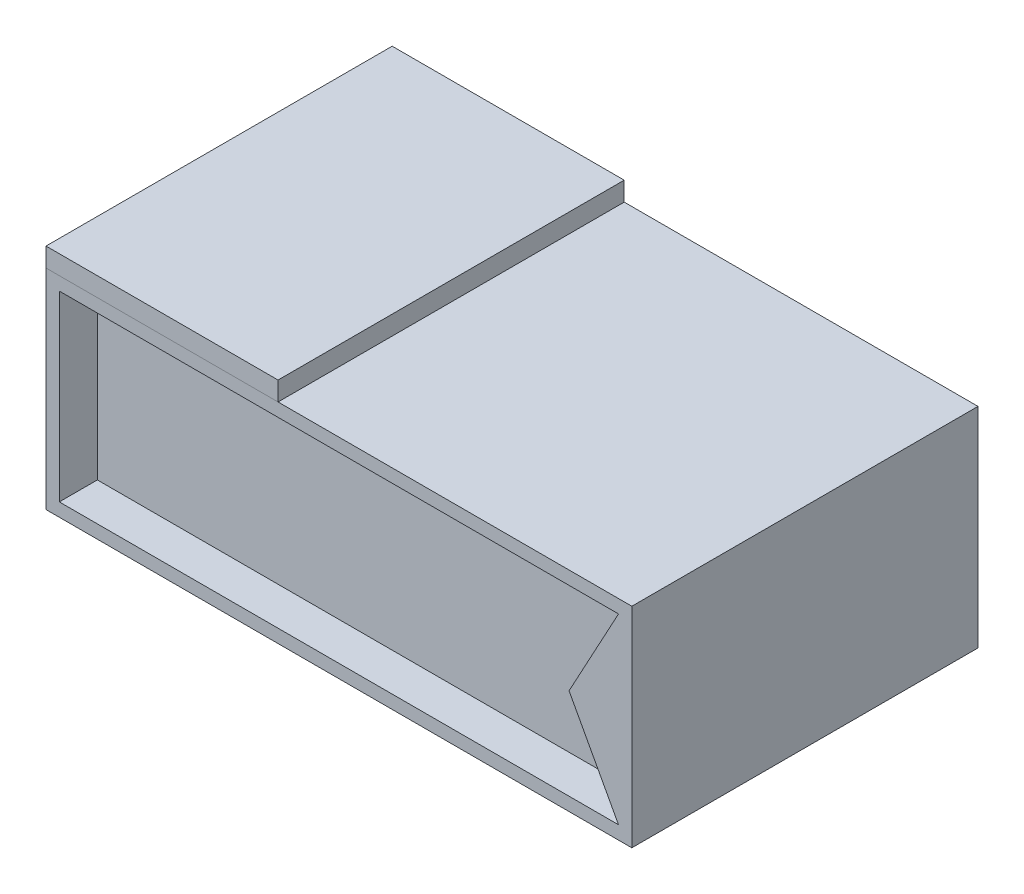
from build123d import *

# Parameters (mm, degrees)
ESQUISSE1_W             = 91
ESQUISSE1_H             = 55
BOSS_EXTRU_1_DEPTH      = 77
ESQUISSE3_W             = 61
ESQUISSE3_H             = 91
BOSS_EXTRU_2_DEPTH      = 5
ENL_V_MAT_EXTRU_1_DEPTH = 10


with BuildPart() as part:
    # Esquisse1 → Boss.-Extru.1 (new, symmetric)
    with BuildSketch(Plane(origin=(0, 0, 0), x_dir=(0, 0, -1), z_dir=(1, 0, 0))):
        Rectangle(ESQUISSE1_W, ESQUISSE1_H)
    extrude(amount=BOSS_EXTRU_1_DEPTH, both=True)

    # Esquisse4 → Enlèv. mat.-Extru.1 (cut)
    with BuildSketch(Plane.XY.offset(45.5)):
        Polygon((-73.5, 24), (73.5, 24), (60.5, 0), (73.5, -24), (-73.5, -24), align=None)
    enl_v_mat_extru_1 = extrude(amount=-ENL_V_MAT_EXTRU_1_DEPTH, mode=Mode.SUBTRACT)

    # Symétrie1: Enlèv. mat.-Extru.1 across plane
    add(enl_v_mat_extru_1.mirror(Plane.XY), mode=Mode.SUBTRACT)


with BuildPart() as body_2:
    # Esquisse3 → Boss.-Extru.2 (new body)
    with BuildSketch(Plane(origin=(0, 27.5, 0), x_dir=(1, 0, 0), z_dir=(0, 1, 0))):
        with Locations((-46.5, 0)):
            Rectangle(ESQUISSE3_W, ESQUISSE3_H)
    extrude(amount=BOSS_EXTRU_2_DEPTH)


solid = Compound([part.part, body_2.part])
